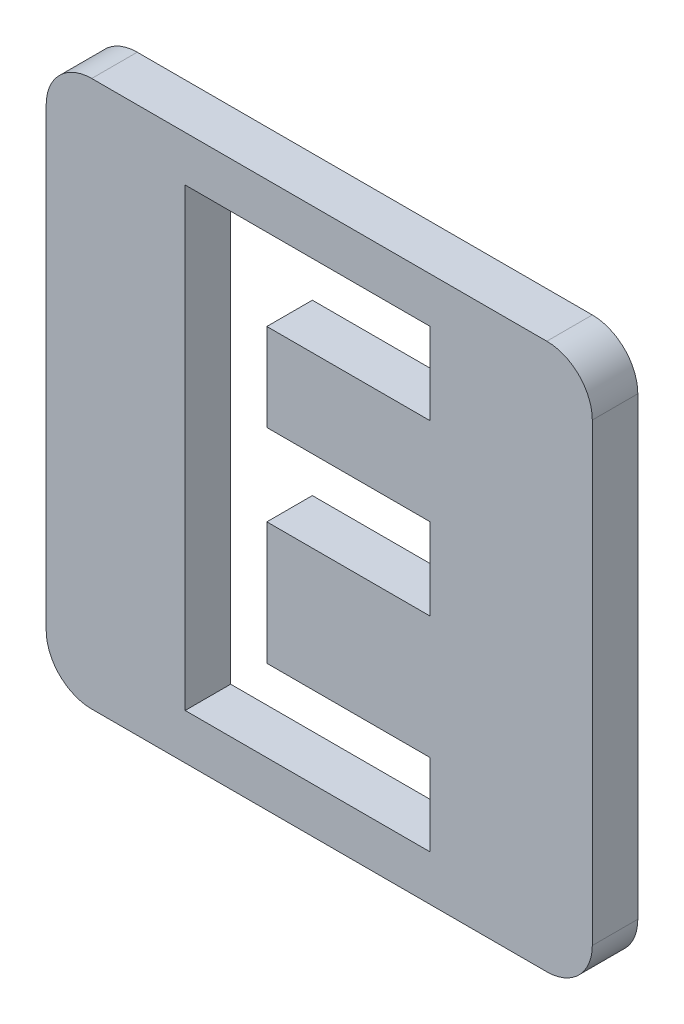
from build123d import *

# Parameters (mm, degrees)
BOSS_EXTRUDE1_DEPTH = 10
CUT_EXTRUDE18_DEPTH = 10


with BuildPart() as part:
    # Sketch1 → Boss-Extrude1 (new body)
    with BuildSketch(Plane.XY):
        with BuildLine():
            Line((-50, 60), (50, 60))
            ThreePointArc((50, 60), (57.071067812, 57.071067812), (60, 50))
            Line((60, 50), (60, -50))
            ThreePointArc((60, -50), (57.071067812, -57.071067812), (50, -60))
            Line((50, -60), (-50, -60))
            ThreePointArc((-50, -60), (-57.071067812, -57.071067812), (-60, -50))
            Line((-60, -50), (-60, 50))
            ThreePointArc((-60, 50), (-57.071067812, 57.071067812), (-50, 60))
        make_face()
    extrude(amount=BOSS_EXTRUDE1_DEPTH)

    # Sketch2 → Cut-Extrude18 (cut)
    with BuildSketch(Plane.XY.offset(10)):
        Polygon((-29.461538462, 50), (24.384615385, 50), (24.384615385, 32.051282051), (-11.512820513, 32.051282051), (-11.512820513, 12.820512821), (24.384615385, 12.820512821), (24.384615385, -5.128205128), (-11.512820513, -5.128205128), (-11.512820513, -32.051282051), (24.384615385, -32.051282051), (24.384615385, -50), (-29.461538462, -50), align=None)
    extrude(amount=-CUT_EXTRUDE18_DEPTH, mode=Mode.SUBTRACT)


solid = part.part
